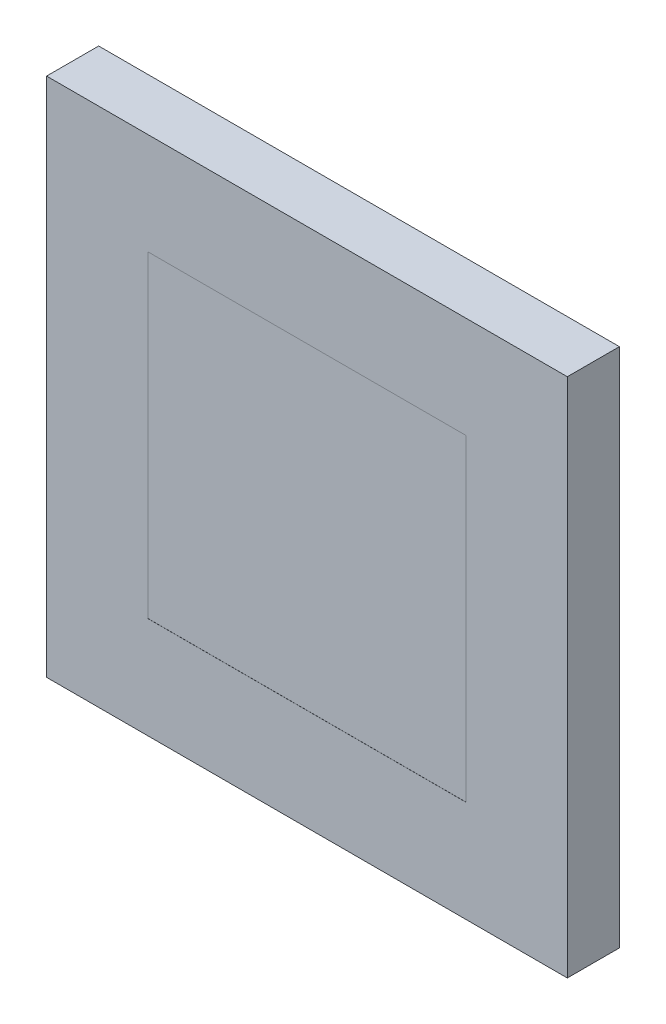
from build123d import *

# Parameters (mm, degrees)
SKETCH1_W           = 500
SKETCH1_H           = 500
BOSS_EXTRUDE1_DEPTH = 50
SKETCH2_W           = 305
SKETCH2_H           = 305
CUT_EXTRUDE1_DEPTH  = 0.1


with BuildPart() as part:
    # Sketch1 → Boss-Extrude1 (new body)
    with BuildSketch(Plane.XY):
        with Locations((250, 250)):
            Rectangle(SKETCH1_W, SKETCH1_H)
    extrude(amount=BOSS_EXTRUDE1_DEPTH)

    # Sketch2 → Cut-Extrude1 (cut)
    with BuildSketch(Plane.XY.offset(50)):
        with Locations((250, 250)):
            Rectangle(SKETCH2_W, SKETCH2_H)
    extrude(amount=-CUT_EXTRUDE1_DEPTH, mode=Mode.SUBTRACT)


solid = part.part
